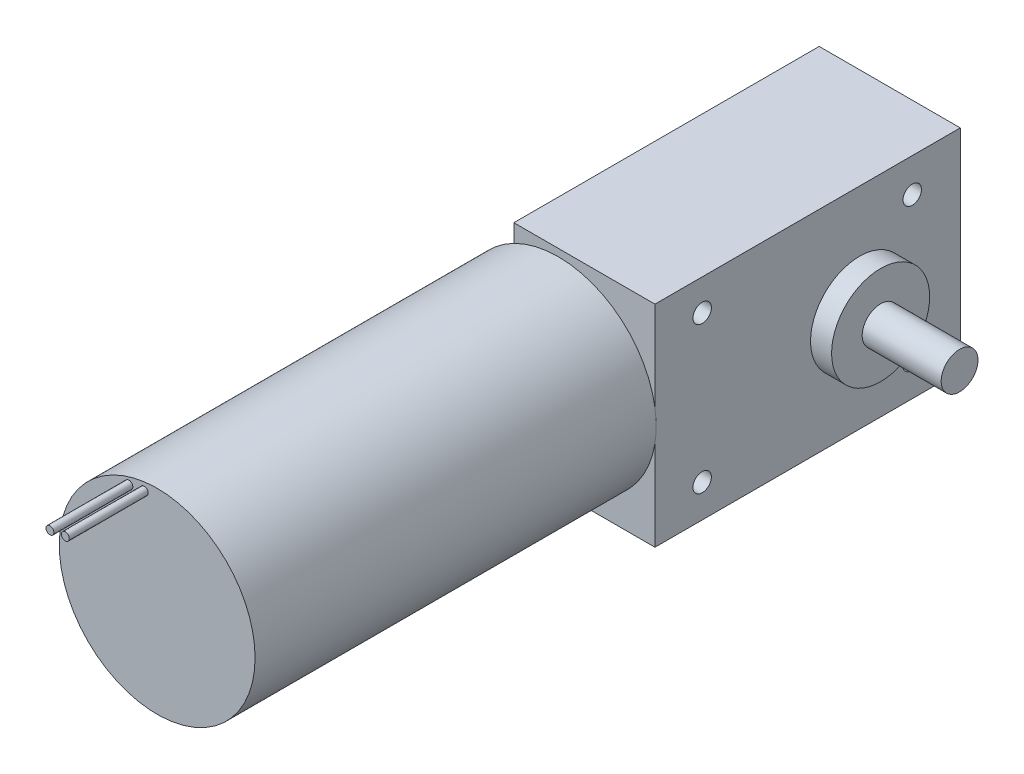
from build123d import *

# Parameters (mm, degrees)
SKETCH4_R           = 18.6
BOSS_EXTRUDE3_DEPTH = 76.2
SKETCH5_R           = 0.75
BOSS_EXTRUDE4_DEPTH = 15
SKETCH6_R           = 0.75
BOSS_EXTRUDE5_DEPTH = 15
SKETCH7_W           = 26.8
SKETCH7_H           = 40
BOSS_EXTRUDE6_DEPTH = 58
SKETCH8_R           = 1.75
CUT_EXTRUDE1_DEPTH  = 5
SKETCH9_R           = 1.75
CUT_EXTRUDE2_DEPTH  = 5
SKETCH10_R          = 1.75
CUT_EXTRUDE3_DEPTH  = 5
SKETCH11_R          = 1.75
CUT_EXTRUDE4_DEPTH  = 5
SKETCH12_R          = 9.4
BOSS_EXTRUDE7_DEPTH = 4
SKETCH13_R          = 1.75
CUT_EXTRUDE5_DEPTH  = 10
SKETCH14_R          = 1.75
CUT_EXTRUDE6_DEPTH  = 10
SKETCH17_R          = 1.75
CUT_EXTRUDE7_DEPTH  = 10
SKETCH18_R          = 1.75
CUT_EXTRUDE8_DEPTH  = 10
SKETCH19_R          = 9.315
BOSS_EXTRUDE8_DEPTH = 4
SKETCH21_R          = 3.5
BOSS_EXTRUDE9_DEPTH = 15


with BuildPart() as part:
    # Sketch4 → Boss-Extrude3 (new body)
    with BuildSketch(Plane.XY):
        with Locations(Location((-63.856856352, 21.865677116, 0), (0, 0, 180))):
            Circle(SKETCH4_R)
    extrude(amount=BOSS_EXTRUDE3_DEPTH)

    # Sketch5 → Boss-Extrude4 (add)
    with BuildSketch(Plane.XY.offset(76.2)):
        with Locations((-66.305296551, 38.820097555)):
            Circle(SKETCH5_R)
    extrude(amount=BOSS_EXTRUDE4_DEPTH)

    # Sketch6 → Boss-Extrude5 (add)
    with BuildSketch(Plane.XY.offset(76.2)):
        with Locations((-69.224873833, 38.364991381)):
            Circle(SKETCH6_R)
    extrude(amount=BOSS_EXTRUDE5_DEPTH)

    # Sketch7 → Boss-Extrude6 (add)
    with BuildSketch(Plane(origin=(0, 0, 0), x_dir=(-1, 0, 0), z_dir=(0, 0, -1))):
        with Locations((58.895304338, 21.83595021)):
            Rectangle(SKETCH7_W, SKETCH7_H)
    extrude(amount=BOSS_EXTRUDE6_DEPTH)

    # Sketch8 → Cut-Extrude1 (cut)
    with BuildSketch(Plane.ZY.offset(72.295304338)):
        with Locations((-48.85, 35.53595021)):
            Circle(SKETCH8_R)
    extrude(amount=-CUT_EXTRUDE1_DEPTH, mode=Mode.SUBTRACT)

    # Sketch9 → Cut-Extrude2 (cut)
    with BuildSketch(Plane.ZY.offset(72.295304338)):
        with Locations((-9.15, 35.53595021)):
            Circle(SKETCH9_R)
    extrude(amount=-CUT_EXTRUDE2_DEPTH, mode=Mode.SUBTRACT)

    # Sketch10 → Cut-Extrude3 (cut)
    with BuildSketch(Plane.ZY.offset(72.295304338)):
        with Locations((-48.85, 6.77595021)):
            Circle(SKETCH10_R)
    extrude(amount=-CUT_EXTRUDE3_DEPTH, mode=Mode.SUBTRACT)

    # Sketch11 → Cut-Extrude4 (cut)
    with BuildSketch(Plane.ZY.offset(72.295304338)):
        with Locations((-9.15, 6.77595021)):
            Circle(SKETCH11_R)
    extrude(amount=-CUT_EXTRUDE4_DEPTH, mode=Mode.SUBTRACT)

    # Sketch12 → Boss-Extrude7 (add)
    with BuildSketch(Plane.ZY.offset(72.295304338)):
        with Locations(Location((-38.6, 21.23595021, 0), (0, 0, 180))):
            Circle(SKETCH12_R)
    extrude(amount=BOSS_EXTRUDE7_DEPTH)

    # Sketch13 → Cut-Extrude5 (cut)
    with BuildSketch(Plane(origin=(-45.495304338, 0, 0), x_dir=(0, 0, -1), z_dir=(1, 0, 0))):
        with Locations((8.97, 35.91595021)):
            Circle(SKETCH13_R)
    extrude(amount=-CUT_EXTRUDE5_DEPTH, mode=Mode.SUBTRACT)

    # Sketch14 → Cut-Extrude6 (cut)
    with BuildSketch(Plane(origin=(-45.495304338, 0, 0), x_dir=(0, 0, -1), z_dir=(1, 0, 0))):
        with Locations((8.97, 8.06595021)):
            Circle(SKETCH14_R)
    extrude(amount=-CUT_EXTRUDE6_DEPTH, mode=Mode.SUBTRACT)

    # Sketch17 → Cut-Extrude7 (cut)
    with BuildSketch(Plane(origin=(-45.495304338, 0, 0), x_dir=(0, 0, -1), z_dir=(1, 0, 0))):
        with Locations((48.78, 8.26595021)):
            Circle(SKETCH17_R)
    extrude(amount=-CUT_EXTRUDE7_DEPTH, mode=Mode.SUBTRACT)

    # Sketch18 → Cut-Extrude8 (cut)
    with BuildSketch(Plane(origin=(-45.495304338, 0, 0), x_dir=(0, 0, -1), z_dir=(1, 0, 0))):
        with Locations((48.88, 35.40595021)):
            Circle(SKETCH18_R)
    extrude(amount=-CUT_EXTRUDE8_DEPTH, mode=Mode.SUBTRACT)

    # Sketch19 → Boss-Extrude8 (add)
    with BuildSketch(Plane(origin=(-45.495304338, 0, 0), x_dir=(0, 0, -1), z_dir=(1, 0, 0))):
        with Locations(Location((38.87, 20.96595021, 0), (0, 0, 180))):
            Circle(SKETCH19_R)
    extrude(amount=BOSS_EXTRUDE8_DEPTH)

    # Sketch21 → Boss-Extrude9 (add)
    with BuildSketch(Plane(origin=(-41.495304338, 0, 0), x_dir=(0, 0, -1), z_dir=(1, 0, 0))):
        with Locations((38.87, 20.96595021)):
            Circle(SKETCH21_R)
    extrude(amount=BOSS_EXTRUDE9_DEPTH)


solid = part.part
